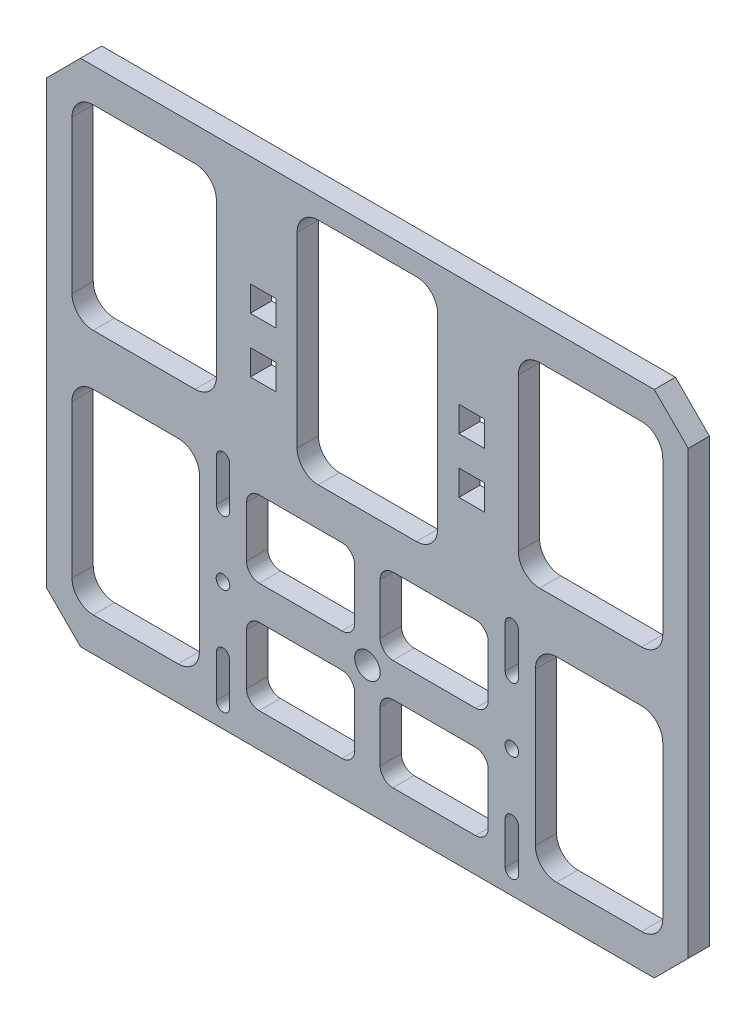
from build123d import *

# Parameters (mm, degrees)
SKETCH_1_W          = 151.1
SKETCH_1_H          = 60
SKETCH_1_R          = 3
SKETCH_1_R_2        = 1.6
SKETCH_1_W_2        = 3.1
SKETCH_1_H_2        = 10
EXTRUDE_1_DEPTH     = 5
SKETCH_2_R          = 1.55
SKETCH_2_W          = 25.45
SKETCH_2_H          = 18
CUT_EXTRUDE_1_DEPTH = 82.442019253
FILLET_1_R          = 3
SKETCH_3_W          = 151.1
SKETCH_3_H          = 60
SKETCH_3_W_2        = 6
SKETCH_3_H_2        = 6
SKETCH_3_W_3        = 33.1
SKETCH_3_H_3        = 54
EXTRUDE_2_DEPTH     = 5
SKETCH_4_W          = 34
SKETCH_4_H          = 46
SKETCH_4_W_2        = 30
CUT_EXTRUDE_2_DEPTH = 118.612935088
FILLET_2_R          = 5
CHAMFER_1_SIZE      = 8


with BuildPart() as part:
    # 草图1 → 凸台-拉伸1 (new body)
    with BuildSketch(Plane.XY):
        Rectangle(SKETCH_1_W, SKETCH_1_H)
        Circle(SKETCH_1_R, mode=Mode.SUBTRACT)
        with Locations((34, 0)):
            Circle(SKETCH_1_R_2, mode=Mode.SUBTRACT)
        with Locations((-34, 0)):
            Circle(SKETCH_1_R_2, mode=Mode.SUBTRACT)
        with Locations((34, -20)):
            Rectangle(SKETCH_1_W_2, SKETCH_1_H_2, mode=Mode.SUBTRACT)
        with Locations((-34, 20)):
            Rectangle(SKETCH_1_W_2, SKETCH_1_H_2, mode=Mode.SUBTRACT)
        with Locations((-34, -20)):
            Rectangle(SKETCH_1_W_2, SKETCH_1_H_2, mode=Mode.SUBTRACT)
        with Locations((34, 20)):
            Rectangle(SKETCH_1_W_2, SKETCH_1_H_2, mode=Mode.SUBTRACT)
    extrude(amount=EXTRUDE_1_DEPTH)

    # 草图2 → 切除-拉伸1 (cut, through all)
    with BuildSketch(Plane.XY.offset(5)):
        with Locations((-34, 25)):
            Circle(SKETCH_2_R)
        with Locations((-34, 15)):
            Circle(SKETCH_2_R)
        with Locations((34, 25)):
            Circle(SKETCH_2_R)
        with Locations((34, 15)):
            Circle(SKETCH_2_R)
        with Locations((34, -15)):
            Circle(SKETCH_2_R)
        with Locations((34, -25)):
            Circle(SKETCH_2_R)
        with Locations((-34, -15)):
            Circle(SKETCH_2_R)
        with Locations((-34, -25)):
            Circle(SKETCH_2_R)
        with Locations((-15.725, 13)):
            Rectangle(SKETCH_2_W, SKETCH_2_H)
        with Locations((15.725, 13)):
            Rectangle(SKETCH_2_W, SKETCH_2_H)
        with Locations((-15.725, -13)):
            Rectangle(SKETCH_2_W, SKETCH_2_H)
        with Locations((15.725, -13)):
            Rectangle(SKETCH_2_W, SKETCH_2_H)
    extrude(amount=-CUT_EXTRUDE_1_DEPTH, mode=Mode.SUBTRACT)

    # 圆角1
    fillet_1_edges = [part.edges().sort_by_distance(p)[0] for p in [
        (28.45, 4, 2.5),
        (3, 4, 2.5),
        (3, 22, 2.5),
        (28.45, 22, 2.5),
        (-28.45, -22, 2.5),
        (-28.45, -4, 2.5),
        (-3, -4, 2.5),
        (-3, -22, 2.5),
        (28.45, -22, 2.5),
        (3, -22, 2.5),
        (3, -4, 2.5),
        (28.45, -4, 2.5),
        (-28.45, 4, 2.5),
        (-28.45, 22, 2.5),
        (-3, 22, 2.5),
        (-3, 4, 2.5),
    ]]
    fillet(fillet_1_edges, radius=FILLET_1_R)

    # 草图3 → 凸台-拉伸2 (add)
    with BuildSketch(Plane.XY.offset(5)):
        with Locations((0, 60)):
            Rectangle(SKETCH_3_W, SKETCH_3_H)
        with Locations((24.55, 48)):
            Rectangle(SKETCH_3_W_2, SKETCH_3_H_2, mode=Mode.SUBTRACT)
        with Locations((-24.55, 61)):
            Rectangle(SKETCH_3_W_2, SKETCH_3_H_2, mode=Mode.SUBTRACT)
        with Locations((-24.55, 48)):
            Rectangle(SKETCH_3_W_2, SKETCH_3_H_2, mode=Mode.SUBTRACT)
        with Locations((24.55, 61)):
            Rectangle(SKETCH_3_W_2, SKETCH_3_H_2, mode=Mode.SUBTRACT)
        with Locations((0, 58)):
            Rectangle(SKETCH_3_W_3, SKETCH_3_H_3, mode=Mode.SUBTRACT)
    extrude(amount=-EXTRUDE_2_DEPTH)

    # 草图4 → 切除-拉伸2 (cut, through all)
    with BuildSketch(Plane.XY.offset(5)):
        with Locations((-52.55, 59)):
            Rectangle(SKETCH_4_W, SKETCH_4_H)
        with Locations((-54.55, 1)):
            Rectangle(SKETCH_4_W_2, SKETCH_4_H)
        with Locations((54.55, 1)):
            Rectangle(SKETCH_4_W_2, SKETCH_4_H)
        with Locations((52.55, 59)):
            Rectangle(SKETCH_4_W, SKETCH_4_H)
    extrude(amount=-CUT_EXTRUDE_2_DEPTH, mode=Mode.SUBTRACT)

    # 圆角2
    fillet_2_edges = [part.edges().sort_by_distance(p)[0] for p in [
        (-16.55, 85, 2.5),
        (16.55, 85, 2.5),
        (16.55, 31, 2.5),
        (-16.55, 31, 2.5),
        (69.55, 82, 2.5),
        (69.55, 36, 2.5),
        (35.55, 36, 2.5),
        (35.55, 82, 2.5),
        (69.55, 24, 2.5),
        (69.55, -22, 2.5),
        (39.55, -22, 2.5),
        (39.55, 24, 2.5),
        (-69.55, -22, 2.5),
        (-69.55, 24, 2.5),
        (-39.55, 24, 2.5),
        (-39.55, -22, 2.5),
        (-69.55, 36, 2.5),
        (-69.55, 82, 2.5),
        (-35.55, 82, 2.5),
        (-35.55, 36, 2.5),
    ]]
    fillet(fillet_2_edges, radius=FILLET_2_R)

    # 倒角1
    chamfer_1_edges = [part.edges().sort_by_distance(p)[0] for p in [
        (-75.55, 90, 2.5),
        (75.55, 90, 2.5),
        (75.55, -30, 2.5),
        (-75.55, -30, 2.5),
    ]]
    chamfer(chamfer_1_edges, length=CHAMFER_1_SIZE)


solid = part.part
